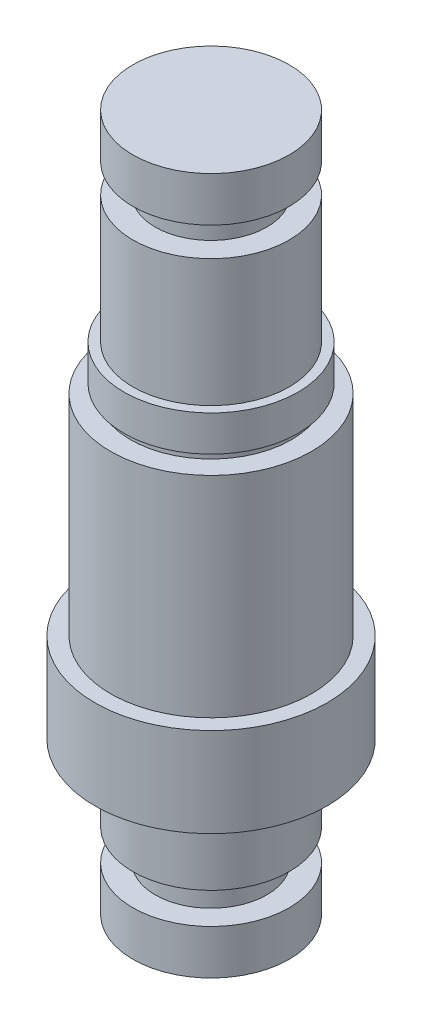
from build123d import *


with BuildPart() as part:
    # 草图1 → 旋转1 (revolve)
    with BuildSketch(Plane.XY):
        Polygon((0, 0), (0, 156), (17.5, 156), (17.5, 146), (12.5, 146), (12.5, 139.5), (17.5, 139.5), (17.5, 111), (19.5, 111), (19.5, 103), (18, 103), (18, 101), (22.5, 101), (22.5, 54), (26, 54), (26, 34), (17.5, 34), (17.5, 17), (12.5, 17), (12.5, 10), (17.5, 10), (17.5, 0), align=None)
    revolve(axis=Axis((0, -1000, 0), (0, 1, 0)))


solid = part.part
